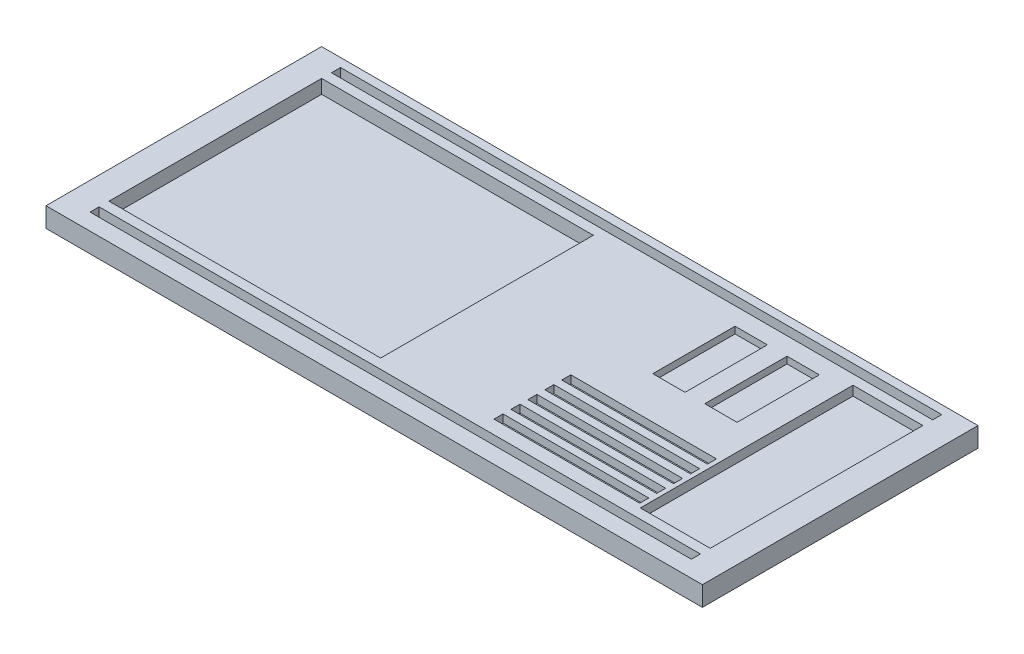
from build123d import *

# Parameters (mm, degrees)
SKETCH1_W           = 166.7
SKETCH1_H           = 70
BOSS_EXTRUDE2_DEPTH = 5
SKETCH2_W           = 69
SKETCH2_H           = 54
CUT_EXTRUDE1_DEPTH  = 3.5
SKETCH4_W           = 8.2
SKETCH4_H           = 20.89
CUT_EXTRUDE3_DEPTH  = 1.7
SKETCH3_W           = 17.75
SKETCH3_H           = 54
CUT_EXTRUDE4_DEPTH  = 2.4
SKETCH5_W           = 152.7
SKETCH5_H           = 2.3
CUT_EXTRUDE5_DEPTH  = 2.3
SKETCH6_W           = 37
SKETCH6_H           = 2.3
CUT_EXTRUDE7_DEPTH  = 2


with BuildPart() as part:
    # Sketch1 → Boss-Extrude2 (new body)
    with BuildSketch(Plane(origin=(0, 0, 0), x_dir=(1, 0, 0), z_dir=(0, 1, 0))):
        Rectangle(SKETCH1_W, SKETCH1_H)
    extrude(amount=BOSS_EXTRUDE2_DEPTH)

    # Sketch2 → Cut-Extrude1 (cut)
    with BuildSketch(Plane(origin=(0, 5, 0), x_dir=(1, 0, 0), z_dir=(0, 1, 0))):
        with Locations((-41.85, 1)):
            Rectangle(SKETCH2_W, SKETCH2_H)
    extrude(amount=-CUT_EXTRUDE1_DEPTH, mode=Mode.SUBTRACT)

    # Sketch4 → Cut-Extrude3 (cut)
    with BuildSketch(Plane(origin=(0, 5, 0), x_dir=(1, 0, 0), z_dir=(0, 1, 0))):
        with Locations((34.75, 15.555)):
            Rectangle(SKETCH4_W, SKETCH4_H)
        with Locations((47.95, 15.559824889)):
            Rectangle(SKETCH4_W, SKETCH4_H)
    extrude(amount=-CUT_EXTRUDE3_DEPTH, mode=Mode.SUBTRACT)

    # Sketch3 → Cut-Extrude4 (cut)
    with BuildSketch(Plane(origin=(0, 5, 0), x_dir=(1, 0, 0), z_dir=(0, 1, 0))):
        with Locations((67.475, 1)):
            Rectangle(SKETCH3_W, SKETCH3_H)
    extrude(amount=-CUT_EXTRUDE4_DEPTH, mode=Mode.SUBTRACT)

    # Sketch5 → Cut-Extrude5 (cut)
    with BuildSketch(Plane(origin=(0, 5, 0), x_dir=(1, 0, 0), z_dir=(0, 1, 0))):
        with Locations((0, -29.65)):
            Rectangle(SKETCH5_W, SKETCH5_H)
        with Locations((0, 31.65)):
            Rectangle(SKETCH5_W, SKETCH5_H)
    extrude(amount=-CUT_EXTRUDE5_DEPTH, mode=Mode.SUBTRACT)

    # Sketch6 → Cut-Extrude7 (cut)
    with BuildSketch(Plane(origin=(0, 5, 0), x_dir=(1, 0, 0), z_dir=(0, 1, 0))):
        with Locations((38.977751303, -19.59833207)):
            Rectangle(SKETCH6_W, SKETCH6_H)
        with Locations((38.977751303, -15.29833207)):
            Rectangle(SKETCH6_W, SKETCH6_H)
        with Locations((38.977751303, -10.99833207)):
            Rectangle(SKETCH6_W, SKETCH6_H)
        with Locations((38.977751303, -6.69833207)):
            Rectangle(SKETCH6_W, SKETCH6_H)
        with Locations((38.977751303, -23.89833207)):
            Rectangle(SKETCH6_W, SKETCH6_H)
    extrude(amount=-CUT_EXTRUDE7_DEPTH, mode=Mode.SUBTRACT)


solid = part.part
